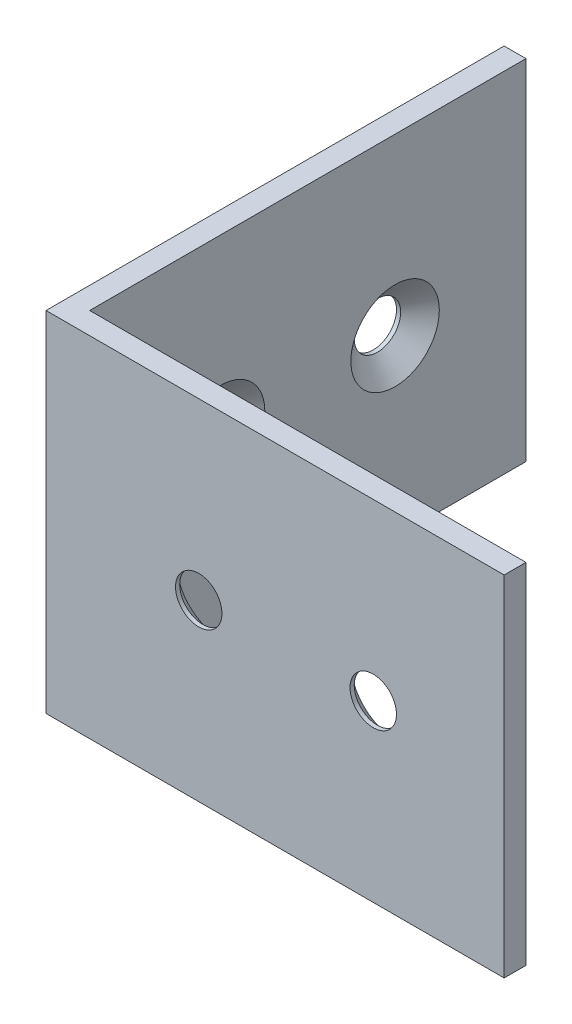
from build123d import *

# Parameters (mm, degrees)
BOSS_EXTRUDE1_DEPTH                            = 50.8
CSK_FOR_1_4_FLAT_HEAD_MACHINE_SCREW_2_COUNT    = 2
CSK_FOR_1_4_FLAT_HEAD_MACHINE_SCREW_2_PITCH    = 25.4
CSK_FOR_1_4_FLAT_HEAD_MACHINE_SCREW_3_AT_COUNT = 2
CSK_FOR_1_4_FLAT_HEAD_MACHINE_SCREW_3_AT_PITCH = 25.4


with BuildPart() as part:
    # Sketch1 → Boss-Extrude1 (new body)
    with BuildSketch(Plane(origin=(0, 0, 0), x_dir=(1, 0, 0), z_dir=(0, 1, 0))):
        Polygon((0, 0), (0, 63.5), (3.175, 63.5), (3.175, 0), (66.675, 0), (66.675, -3.175), (0, -3.175), align=None)
    extrude(amount=BOSS_EXTRUDE1_DEPTH)

    # Sketch4 → CSK for 1_4 Flat Head Machine Screw _100 (revolve, cut)
    with BuildSketch(Plane(origin=(3.175, 25.4, -19.05), x_dir=(0, 0, -1), z_dir=(0, 1, 0))):
        Polygon((0, 0), (0, 3.175), (3.3782, 3.175), (3.3782, 2.568232241), (6.4389, 0), align=None)
    csk_for_1_4_flat_head_machine_screw_100 = revolve(axis=Axis((9.525, 25.4, -19.05), (-1, 0, 0)), mode=Mode.SUBTRACT)

    # CSK for 1_4 Flat Head Machine Screw  2: CSK for 1_4 Flat Head Machine Screw _100 ×2
    with Locations(*[(0, 0, -i * CSK_FOR_1_4_FLAT_HEAD_MACHINE_SCREW_2_PITCH) for i in range(1, CSK_FOR_1_4_FLAT_HEAD_MACHINE_SCREW_2_COUNT)]):
        add(csk_for_1_4_flat_head_machine_screw_100, mode=Mode.SUBTRACT)

    # Sketch6 → CSK for 1_4 Flat Head Machine Screw  3 (revolve, cut)
    with BuildSketch(Plane(origin=(47.625, 25.4, 0), x_dir=(0, 1, 0), z_dir=(1, 0, 0))):
        Polygon((0, 0), (0, 3.175), (3.3782, 3.175), (3.3782, 2.568232241), (6.4389, 0), align=None)
    csk_for_1_4_flat_head_machine_screw_3 = revolve(axis=Axis((47.625, 25.4, -6.35), (0, 0, 1)), mode=Mode.SUBTRACT)

    # CSK for 1_4 Flat Head Machine Screw 3 at: CSK for 1_4 Flat Head Machine Screw  3 ×2
    with Locations(*[(-i * CSK_FOR_1_4_FLAT_HEAD_MACHINE_SCREW_3_AT_PITCH, 0, 0) for i in range(1, CSK_FOR_1_4_FLAT_HEAD_MACHINE_SCREW_3_AT_COUNT)]):
        add(csk_for_1_4_flat_head_machine_screw_3, mode=Mode.SUBTRACT)


solid = part.part
